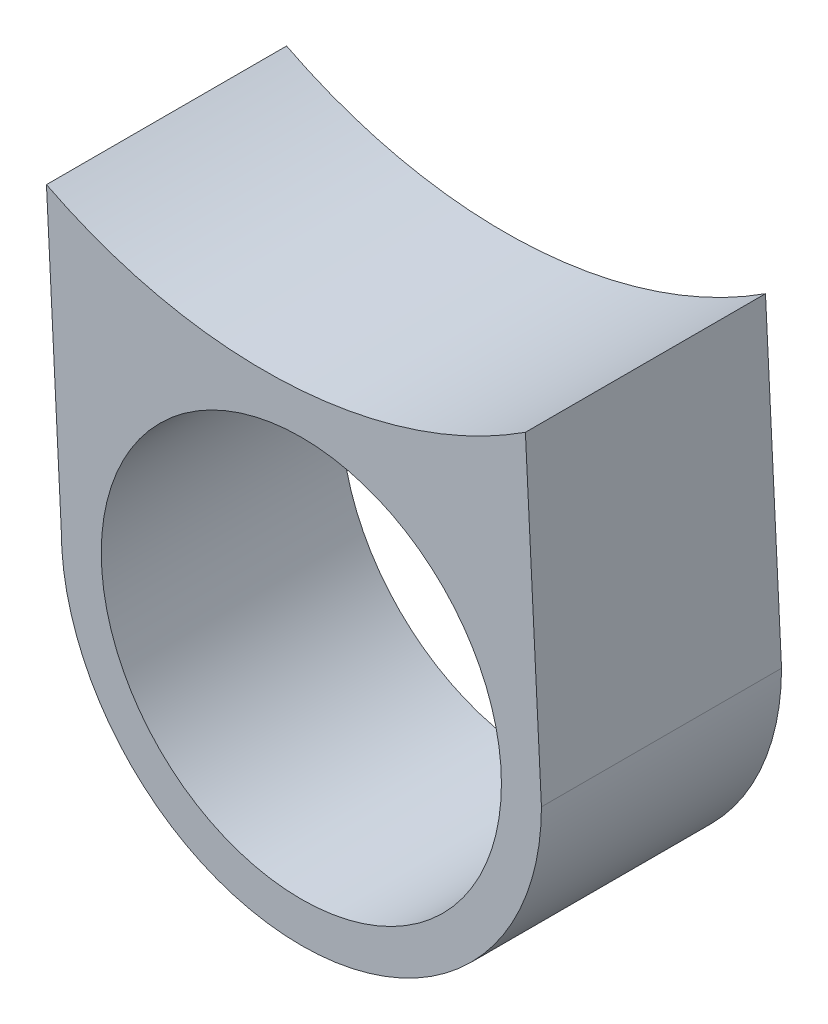
from build123d import *

# Parameters (mm, degrees)
BOSS_EXTRUDE1_DEPTH      = 5
BOSS_EXTRUDE1_DEPTH_BACK = 10
SKETCH1_R                = 12.5


with BuildPart() as part:
    # Sketch1 → Boss-Extrude1 (new, two sides: drawn at the far end of the back side and taken through both)
    with BuildSketch(Plane.XY.offset(-BOSS_EXTRUDE1_DEPTH_BACK)):
        with BuildLine():
            Line((-44.88915592, -28.254421038), (-43.965658713, -46.45807859))
            ThreePointArc((-43.965658713, -46.45807859), (-28.965658713, -61.45807859), (-13.965658713, -46.45807859))
            Line((-13.965658713, -46.45807859), (-14.042670787, -44.940043234))
            Line((-14.042670787, -44.940043234), (-14.968304337, -26.694274815))
            ThreePointArc((-14.968304337, -26.694274815), (-29.72001982, -31.477043366), (-44.88915592, -28.254421038))
        make_face()
        with Locations((-28.965658713, -46.45807859)):
            Circle(SKETCH1_R, mode=Mode.SUBTRACT)
    extrude(amount=BOSS_EXTRUDE1_DEPTH + BOSS_EXTRUDE1_DEPTH_BACK)


solid = part.part
